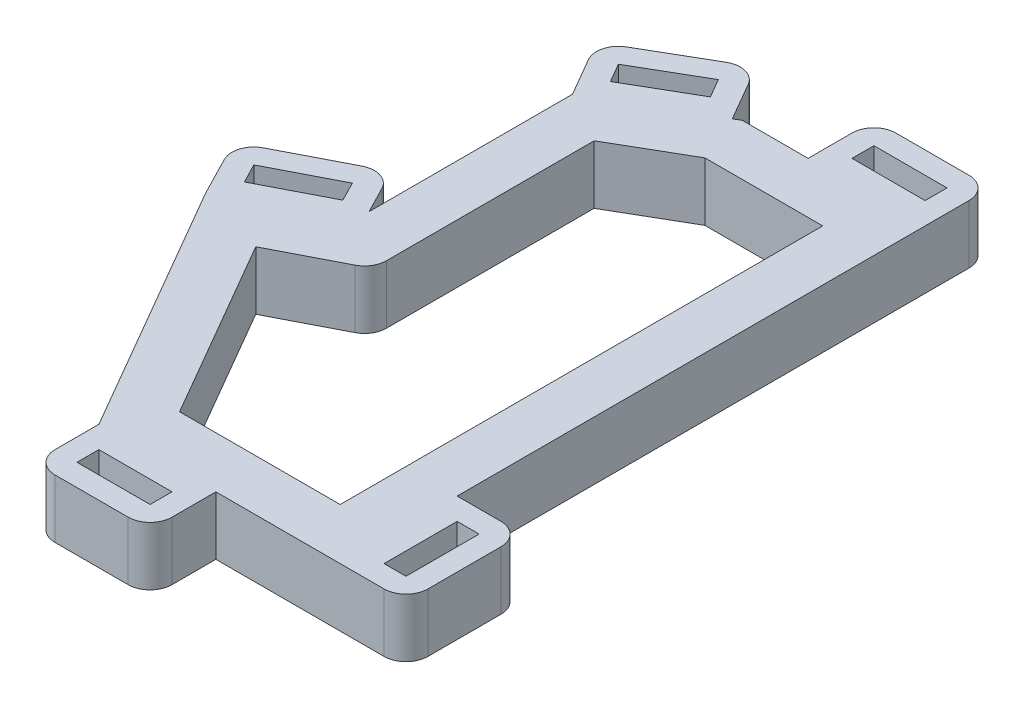
from build123d import *

# Parameters (mm, degrees)
BOSS_EXTRUDE1_DEPTH = 8
SKETCH2_W           = 16
SKETCH2_H           = 9
SKETCH2_W_2         = 10
SKETCH2_H_2         = 3
SKETCH2_W_3         = 9
SKETCH2_H_3         = 16
SKETCH2_W_4         = 3
SKETCH2_H_4         = 10
BOSS_EXTRUDE2_DEPTH = 8
FILLET1_R           = 3


with BuildPart() as part:
    # Sketch1 → Boss-Extrude1 (new body)
    with BuildSketch(Plane(origin=(0, 0, 0), x_dir=(1, 0, 0), z_dir=(0, 1, 0))):
        Polygon((-25, 0), (0, 0), (0, -80), (-33, -80), (-53.047096556, -45.386217778), (-39.710857444, -38.520016036), (-39.710857444, -8.520016036), align=None)
        Polygon((-23.119252614, -7), (-7, -7), (-7, -73), (-28.964892735, -73), (-43.303341696, -48.242901217), (-32.710857444, -42.789329696), (-32.710857444, -12.555123301), align=None, mode=Mode.SUBTRACT)
    extrude(amount=BOSS_EXTRUDE1_DEPTH)

    # Sketch2 → Boss-Extrude2 (add)
    # profile 1 of 5: a face of its own
    with BuildSketch(Plane(origin=(0, 0, 0), x_dir=(1, 0, 0), z_dir=(0, 1, 0))):
        Polygon((-53.047096556, -45.386217778), (-38.821774837, -38.062269253), (-42.941495882, -30.060525786), (-57.166817601, -37.384474311), align=None)
        Polygon((-51.753089082, -41.345729608), (-42.862263008, -36.768261779), (-44.235503356, -34.101013957), (-53.12632943, -38.678481785), align=None, mode=Mode.SUBTRACT)
    # profile 2 of 5: a face of its own
    with BuildSketch(Plane(origin=(0, 0, 0), x_dir=(1, 0, 0), z_dir=(0, 1, 0))):
        Polygon((-39.710857444, -8.520016036), (-25.865344556, -0.501177414), (-30.375941281, 7.286923586), (-44.221454169, -0.731915036), align=None)
        Polygon((-38.618356019, -4.420450128), (-29.964910464, 0.591324011), (-31.468442706, 3.187357678), (-40.121888261, -1.824416461), align=None, mode=Mode.SUBTRACT)
    # profile 3 of 5: a face of its own
    with BuildSketch(Plane(origin=(0, 0, 0), x_dir=(1, 0, 0), z_dir=(0, 1, 0))):
        with Locations((-8, 4.5)):
            Rectangle(SKETCH2_W, SKETCH2_H)
        with Locations((-8, 4.5)):
            Rectangle(SKETCH2_W_2, SKETCH2_H_2, mode=Mode.SUBTRACT)
    # profile 4 of 5: a face of its own
    with BuildSketch(Plane(origin=(0, 0, 0), x_dir=(1, 0, 0), z_dir=(0, 1, 0))):
        with Locations((-25, -84.5)):
            Rectangle(SKETCH2_W, SKETCH2_H)
        with Locations((-25, -84.5)):
            Rectangle(SKETCH2_W_2, SKETCH2_H_2, mode=Mode.SUBTRACT)
    # profile 5 of 5: a face of its own
    with BuildSketch(Plane(origin=(0, 0, 0), x_dir=(1, 0, 0), z_dir=(0, 1, 0))):
        with Locations((4.5, -72)):
            Rectangle(SKETCH2_W_3, SKETCH2_H_3)
        with Locations((4.5, -72)):
            Rectangle(SKETCH2_W_4, SKETCH2_H_4, mode=Mode.SUBTRACT)
    extrude(amount=BOSS_EXTRUDE2_DEPTH)

    # Fillet1
    fillet1_edges = [part.edges().sort_by_distance(p)[0] for p in [
        (0, 4, -9),
        (-16, 4, -9),
        (9, 4, 64),
        (9, 4, 80),
        (-32.710857444, 4, 42.789329696),
        (-42.941495882, 4, 30.060525786),
        (-57.166817601, 4, 37.384474311),
        (-30.375941281, 4, -7.286923586),
        (-44.221454169, 4, 0.731915036),
        (-17, 4, 89),
        (-33, 4, 89),
    ]]
    fillet(fillet1_edges, radius=FILLET1_R)


solid = part.part
